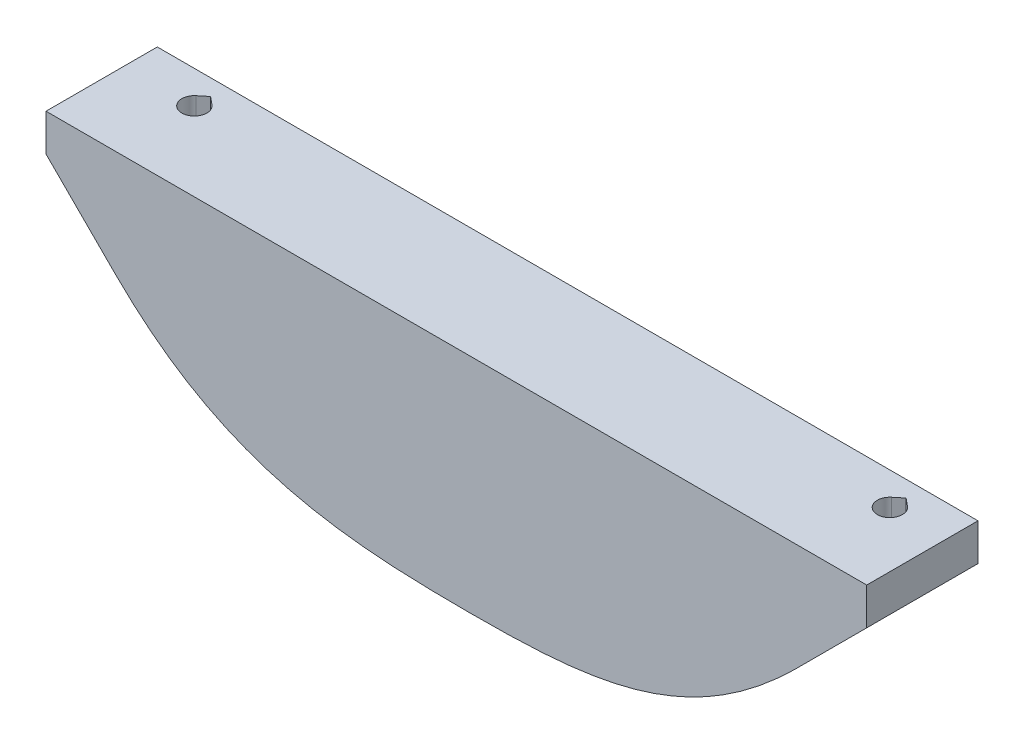
from build123d import *

# Parameters (mm, degrees)
BOSS_EXTRUDE1_DEPTH = 12
SKETCH2_R           = 1.35
CUT_EXTRUDE1_DEPTH  = 93.478375985
SKETCH4_R           = 2.5
CUT_EXTRUDE3_DEPTH  = 37
CUT_EXTRUDE4_DEPTH  = 93.478375985
CUT_EXTRUDE5_DEPTH  = 93.478375985
BOSS_EXTRUDE2_DEPTH = 12


with BuildPart() as part:
    # Sketch1 → Boss-Extrude1 (new body)
    with BuildSketch(Plane.XY):
        with BuildLine():
            Line((88.5, -40), (76.5, -40))
            Line((76.5, -40), (76.5, -44))
            add(Edge.make_bspline(
                [(76.5, -44), (76.5, -50.445206558), (58.353185223, -54), (45.75, -54)],
                knots=[0, 0, 0, 0, 1, 1, 1, 1], degree=3))
            add(Edge.make_bspline(
                [(15, -44), (15, -49.937437985), (29.668022887, -54), (45.75, -54)],
                knots=[0, 0, 0, 0, 1, 1, 1, 1], degree=3))
            Line((15, -44), (15, -40))
            Line((15, -40), (0, -40))
            Line((0, -40), (0, -44))
            Line((0, -44), (7.5, -51.5))
            add(Edge.make_bspline(
                [(7.5, -51.5), (19.073181247, -63.073181247), (31.728934499, -64), (45.75, -64)],
                knots=[0, 0, 0, 0, 1, 1, 1, 1], degree=3))
            add(Edge.make_bspline(
                [(81, -51.5), (69.44210318, -63.05789682), (59.019901197, -64), (45.75, -64)],
                knots=[0, 0, 0, 0, 1, 1, 1, 1], degree=3))
            Line((81, -51.5), (88.5, -44))
            Line((88.5, -44), (88.5, -40))
        make_face()
    extrude(amount=-BOSS_EXTRUDE1_DEPTH)

    # Sketch2 → Cut-Extrude1 (cut, through all)
    with BuildSketch(Plane(origin=(0, -40, 0), x_dir=(1, 0, 0), z_dir=(0, 1, 0))):
        with Locations(Location((82.5, 8.5, 0), (0, 0, 270))):
            Circle(SKETCH2_R)
        with Locations(Location((7.5, 8.5, 0), (0, 0, 270))):
            Circle(SKETCH2_R)
    extrude(amount=-CUT_EXTRUDE1_DEPTH, mode=Mode.SUBTRACT)

    # Sketch4 → Cut-Extrude3 (cut)
    with BuildSketch(Plane(origin=(0, -80, 0), x_dir=(1, 0, 0), z_dir=(0, 1, 0))):
        with Locations(Location((7.5, 8.5, 0), (0, 0, 270))):
            Circle(SKETCH4_R)
        with Locations(Location((82.5, 8.5, 0), (0, 0, 126.869897646))):
            Circle(SKETCH4_R)
    extrude(amount=CUT_EXTRUDE3_DEPTH, mode=Mode.SUBTRACT)

    # Sketch7 → Cut-Extrude4 (cut, through all)
    with BuildSketch(Plane(origin=(0, -40, 0), x_dir=(1, 0, 0), z_dir=(0, 1, 0))):
        with BuildLine():
            Line((7.5, 10.25), (8.359026502, 9.541428571))
            ThreePointArc((8.359026502, 9.541428571), (7.5, 9.85), (6.640973498, 9.541428571))
            Line((6.640973498, 9.541428571), (7.5, 10.25))
        make_face()
    extrude(amount=-CUT_EXTRUDE4_DEPTH, mode=Mode.SUBTRACT)

    # Sketch8 → Cut-Extrude5 (cut, through all)
    with BuildSketch(Plane(origin=(0, -40, 0), x_dir=(1, 0, 0), z_dir=(0, 1, 0))):
        with BuildLine():
            Line((82.5, 10.25), (83.359026502, 9.541428571))
            ThreePointArc((83.359026502, 9.541428571), (82.5, 9.85), (81.640973498, 9.541428571))
            Line((81.640973498, 9.541428571), (82.5, 10.25))
        make_face()
    extrude(amount=-CUT_EXTRUDE5_DEPTH, mode=Mode.SUBTRACT)

    # Sketch9 → Boss-Extrude2 (add)
    with BuildSketch(Plane.XY):
        with BuildLine():
            Line((76.5, -40), (76.5, -44))
            add(Edge.make_bspline(
                [(76.5, -44), (76.5, -50.445206558), (58.353185223, -54), (45.75, -54)],
                knots=[0, 0, 0, 0, 1, 1, 1, 1], degree=3))
            add(Edge.make_bspline(
                [(45.75, -54), (29.668022887, -54), (15, -49.937437985), (15, -44)],
                knots=[0, 0, 0, 0, 1, 1, 1, 1], degree=3))
            Line((15, -44), (15, -40))
            Line((15, -40), (76.5, -40))
        make_face()
    extrude(amount=-BOSS_EXTRUDE2_DEPTH)


solid = part.part
